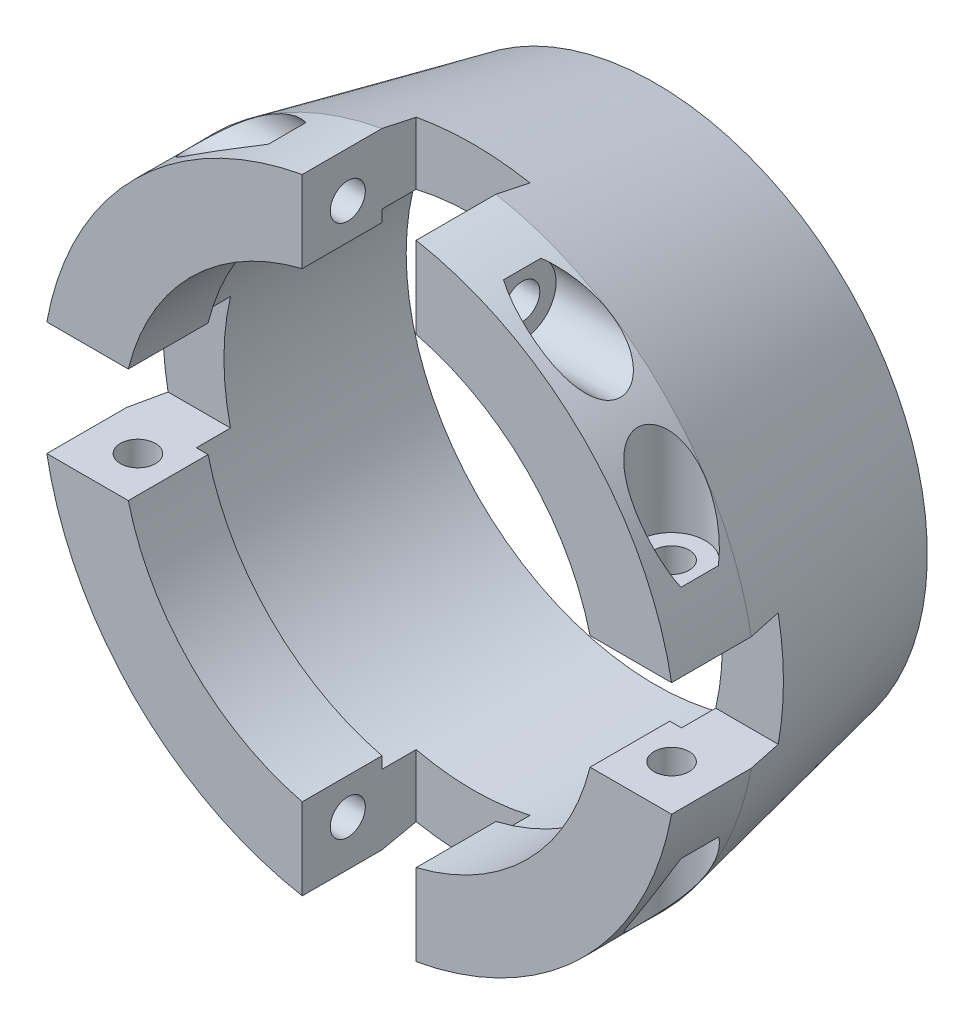
from build123d import *

# Parameters (mm, degrees)
CUT_EXTRUDE2_START = -12.7
SKETCH5_W          = 12.7
SKETCH5_H          = 12.7
CUT_EXTRUDE2_DEPTH = 73.673472495
CIRPATTERN1_COUNT  = 4


with BuildPart() as part:
    # Sketch1 → base_ring (revolve)
    with BuildSketch(Plane.YZ, mode=Mode.PRIVATE) as base_ring_sk:
        Polygon((27.78125, 0), (27.78125, 24.13), (26.51125, 24.13), (26.51125, 33.02), (35.40125, 33.02), (35.40125, 24.13), (30.32125, 0), align=None)
    revolve(base_ring_sk.sketch.rotate(Axis((0, 0, 0), (0, 0, 1)), 90), axis=Axis((0, 0, 0), (0, 0, 1)))

    # Sketch5 → Cut-Extrude2 (cut)
    with BuildSketch(Plane.XY.offset(33.02).offset(CUT_EXTRUDE2_START)):
        with Locations((0, 32.089539168)):
            Rectangle(SKETCH5_W, SKETCH5_H)
    cut_extrude2 = extrude(amount=CUT_EXTRUDE2_DEPTH, mode=Mode.SUBTRACT)

    # Sketch8 → pulley_bolt_hole (revolve, cut)
    with BuildSketch(Plane(origin=(35.40125, 29.747087182, 27.94), x_dir=(0, 0, -1), z_dir=(0, 1, 0))):
        Polygon((0, 0), (0, 39.275163199), (1.9558, 38.1), (1.9558, 22.3012), (3.77063, 22.3012), (3.77063, 0), align=None)
    pulley_bolt_hole = revolve(axis=Axis((41.75125, 29.747087182, 27.94), (-1, 0, 0)), mode=Mode.SUBTRACT)

    # bolthole_mirror: pulley_bolt_hole across plane
    add(pulley_bolt_hole.mirror(Plane(origin=(0, 0, 0), x_dir=(0, 0, 1), z_dir=(1, 0, 0))), mode=Mode.SUBTRACT)

    # CirPattern1: Cut-Extrude2, pulley_bolt_hole ×4 about axis
    cirpattern1_axis = Axis((0, 0, 0), (0, 0, 1))
    add([cut_extrude2.rotate(cirpattern1_axis, i * 360 / CIRPATTERN1_COUNT) for i in range(1, CIRPATTERN1_COUNT)], mode=Mode.SUBTRACT)
    add([pulley_bolt_hole.rotate(cirpattern1_axis, i * 360 / CIRPATTERN1_COUNT) for i in range(1, CIRPATTERN1_COUNT)], mode=Mode.SUBTRACT)

    # CirPattern1 copy 1 sketch → CirPattern1 copy 1 (revolve, cut)
    with BuildSketch(Plane(origin=(-29.747087182, -35.40125, 27.94), x_dir=(0, 0, -1), z_dir=(-1, 0, 0))):
        Polygon((0, 0), (0, -39.275163199), (1.9558, -38.1), (1.9558, -22.3012), (3.77063, -22.3012), (3.77063, 0), align=None)
    revolve(axis=Axis((-29.747087182, -41.75125, 27.94), (0, -1, 0)), mode=Mode.SUBTRACT)

    # CirPattern1 copy 2 sketch → CirPattern1 copy 2 (revolve, cut)
    with BuildSketch(Plane(origin=(35.40125, -29.747087182, 27.94), x_dir=(0, 0, -1), z_dir=(0, -1, 0))):
        Polygon((0, 0), (0, -39.275163199), (1.9558, -38.1), (1.9558, -22.3012), (3.77063, -22.3012), (3.77063, 0), align=None)
    revolve(axis=Axis((41.75125, -29.747087182, 27.94), (1, 0, 0)), mode=Mode.SUBTRACT)

    # CirPattern1 copy 3 sketch → CirPattern1 copy 3 (revolve, cut)
    with BuildSketch(Plane(origin=(29.747087182, 35.40125, 27.94), x_dir=(0, 0, -1), z_dir=(1, 0, 0))):
        Polygon((0, 0), (0, -39.275163199), (1.9558, -38.1), (1.9558, -22.3012), (3.77063, -22.3012), (3.77063, 0), align=None)
    revolve(axis=Axis((29.747087182, 41.75125, 27.94), (0, 1, 0)), mode=Mode.SUBTRACT)


solid = part.part
